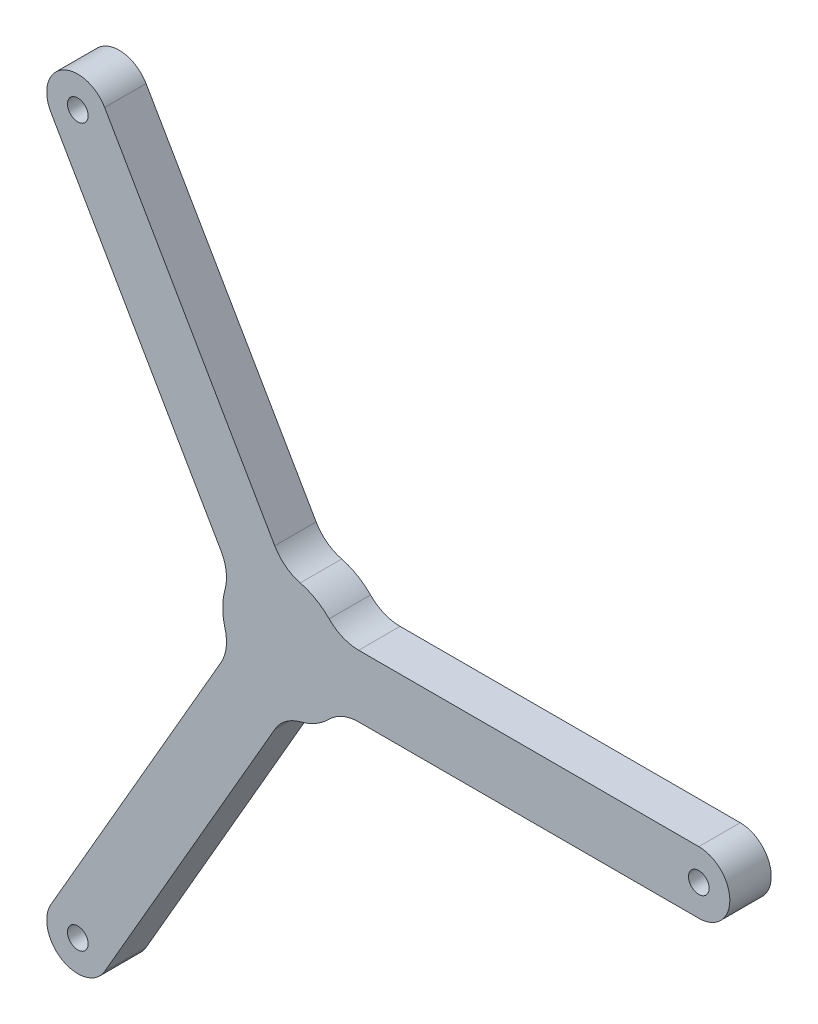
from build123d import *

# Parameters (mm, degrees)
SKETCH1_R                = 2.5
BOSS_EXTRUDE1_DEPTH      = 10
FILLET1_R                = 10
CIRPATTERN2_COUNT        = 3
FILLET1_OF_CIRPATTERN2_R = 10


with BuildPart() as part:
    # Sketch1 → Boss-Extrude1 (new body)
    with BuildSketch(Plane.XY):
        with BuildLine():
            Line((100, 7.5), (12.990381057, 7.5))
            ThreePointArc((12.990381057, 7.5), (-15, 0), (12.990381057, -7.5))
            Line((12.990381057, -7.5), (100, -7.5))
            ThreePointArc((100, -7.5), (107.5, 0), (100, 7.5))
        make_face()
        with Locations((100, 0)):
            Circle(SKETCH1_R, mode=Mode.SUBTRACT)
    boss_extrude1 = extrude(amount=BOSS_EXTRUDE1_DEPTH)

    # Fillet1
    fillet1_edges = [part.edges().sort_by_distance(p)[0] for p in [
        (12.990381057, 7.5, 5),
        (12.990381057, -7.5, 5),
    ]]
    fillet(fillet1_edges, radius=FILLET1_R)

    # CirPattern2: Boss-Extrude1 ×3 about axis
    cirpattern2_axis = Axis((0, 0, 10), (0, 0, -1))
    for i in range(1, CIRPATTERN2_COUNT):
        add(boss_extrude1.rotate(cirpattern2_axis, i * 360 / CIRPATTERN2_COUNT))

    # Fillet1 of CirPattern2
    fillet1_of_cirpattern2_edges = [part.edges().sort_by_distance(p)[0] for p in [
        (0, -15, 5),
        (-12.990381057, -7.5, 5),
        (-12.990381057, 7.5, 5),
        (0, 15, 5),
    ]]
    fillet(fillet1_of_cirpattern2_edges, radius=FILLET1_OF_CIRPATTERN2_R)


solid = part.part
